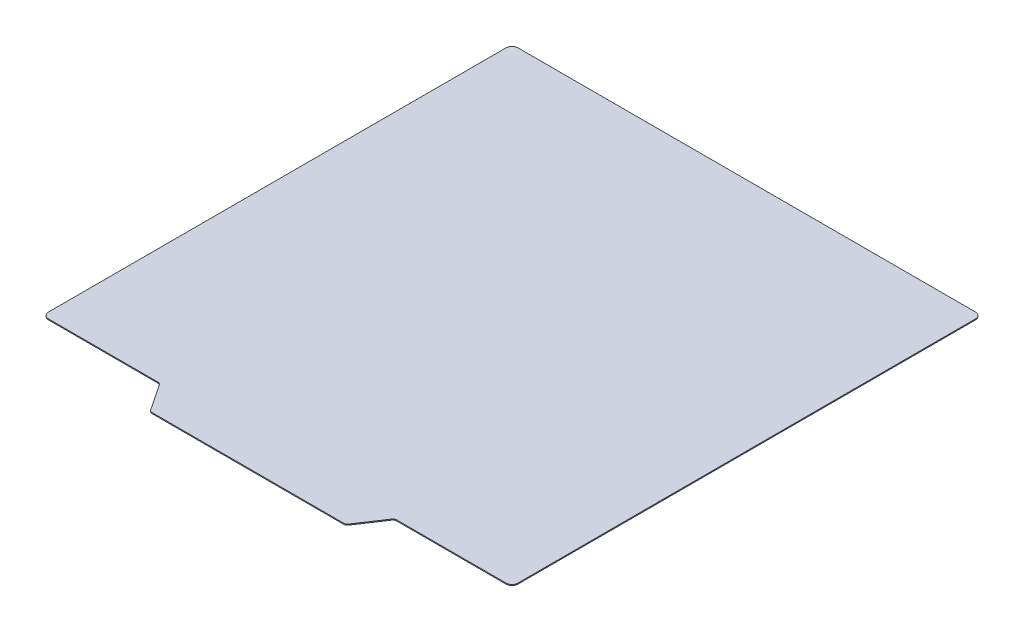
from build123d import *

# Parameters (mm, degrees)
AUFSATZ_LINEAR_AUSTRAGEN1_DEPTH = 0.5
BOSS_EXTRUDE1_DEPTH             = 0.5
FILLET1_R                       = 2


with BuildPart() as part:
    # Skizze1 → Aufsatz-Linear austragen1 (new body)
    with BuildSketch(Plane(origin=(0, 0, 0), x_dir=(1, 0, 0), z_dir=(0, 1, 0))):
        with BuildLine():
            Line((-117, -120), (117, -120))
            ThreePointArc((117, -120), (119.121320344, -119.121320344), (120, -117))
            Line((120, -117), (120, 117))
            ThreePointArc((120, 117), (119.121320344, 119.121320344), (117, 120))
            Line((117, 120), (-117, 120))
            ThreePointArc((-117, 120), (-119.121320344, 119.121320344), (-120, 117))
            Line((-120, 117), (-120, -117))
            ThreePointArc((-120, -117), (-119.121320344, -119.121320344), (-117, -120))
        make_face()
    extrude(amount=AUFSATZ_LINEAR_AUSTRAGEN1_DEPTH)

    # Sketch1 → Boss-Extrude1 (add)
    with BuildSketch(Plane(origin=(0, 0.5, 0), x_dir=(1, 0, 0), z_dir=(0, 1, 0))):
        Polygon((-60, -120), (-50, -135), (50, -135), (60, -120), align=None)
    extrude(amount=-BOSS_EXTRUDE1_DEPTH)

    # Fillet1
    fillet1_edges = [part.edges().sort_by_distance(p)[0] for p in [
        (-60, 0.25, 120),
        (60, 0.25, 120),
        (50, 0.25, 135),
        (-50, 0.25, 135),
    ]]
    fillet(fillet1_edges, radius=FILLET1_R)


solid = part.part
